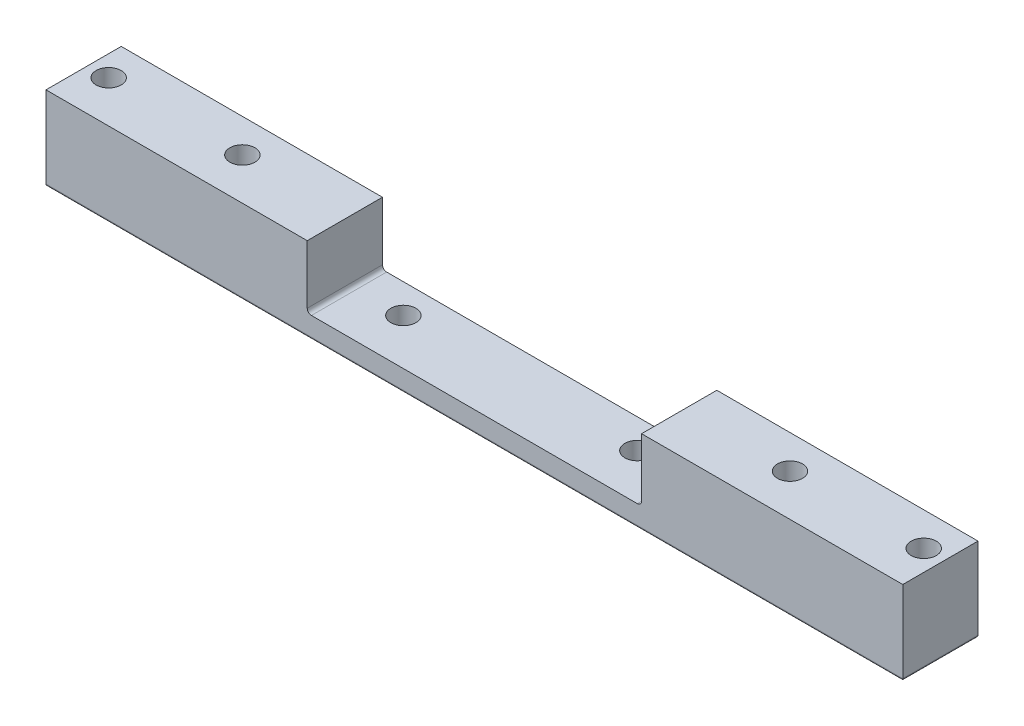
from build123d import *

# Parameters (mm, degrees)
SKETCH1_W             = 62.4967
SKETCH1_H             = 18
SKETCH1_R             = 3
BOSS_EXTRUDE1_DEPTH   = 20
SKETCH1_W_2           = 62.5033
BOSS_EXTRUDE1_2_DEPTH = 20
SKETCH1_3_W           = 80
SKETCH1_3_H           = 18
SKETCH1_3_R           = 3
BOSS_EXTRUDE2_DEPTH   = 5
FILLET1_R             = 0.5
FILLET2_R             = 1


with BuildPart() as part:
    # Sketch1 → Boss-Extrude1 (new body)
    with BuildSketch(Plane(origin=(0, 0, 0), x_dir=(1, 0, 0), z_dir=(0, 1, 0))):
        with Locations((173.75165, -9)):
            Rectangle(SKETCH1_W, SKETCH1_H)
        with Locations((168.0133, -8)):
            Circle(SKETCH1_R, mode=Mode.SUBTRACT)
        with Locations((200.0133, -8)):
            Circle(SKETCH1_R, mode=Mode.SUBTRACT)
    extrude(amount=BOSS_EXTRUDE1_DEPTH)



with BuildPart() as body_2:
    # Sketch1 → Boss-Extrude1 2 (new body)
    with BuildSketch(Plane(origin=(0, 0, 0), x_dir=(1, 0, 0), z_dir=(0, 1, 0))):
        with Locations((31.25165, -9)):
            Rectangle(SKETCH1_W_2, SKETCH1_H)
        with Locations((4.99, -8)):
            Circle(SKETCH1_R, mode=Mode.SUBTRACT)
        with Locations((36.99, -8)):
            Circle(SKETCH1_R, mode=Mode.SUBTRACT)
    extrude(amount=BOSS_EXTRUDE1_2_DEPTH)


with BuildPart() as part_1:
    add(part.part)

    add(body_2.part)  # Boss-Extrude2 merges body 2
    # Sketch1<3> → Boss-Extrude2 (add)
    with BuildSketch(Plane(origin=(0, 0, 0), x_dir=(1, 0, 0), z_dir=(0, 1, 0))):
        with Locations((102.5033, -9)):
            Rectangle(SKETCH1_3_W, SKETCH1_3_H)
        with Locations((74.5033, -7)):
            Circle(SKETCH1_3_R, mode=Mode.SUBTRACT)
        with Locations((130.5033, -7)):
            Circle(SKETCH1_3_R, mode=Mode.SUBTRACT)
    extrude(amount=BOSS_EXTRUDE2_DEPTH)

    # Fillet1
    fillet1_edges = [part_1.edges().sort_by_distance(p)[0] for p in [
        (165.0133, 0, 8),
        (197.0133, 0, 8),
        (71.5033, 0, 7),
        (127.5033, 0, 7),
        (0, 0, 9),
        (102.5, 0, 18),
        (205, 0, 9),
        (102.5, 0, 0),
        (1.99, 0, 8),
        (33.99, 0, 8),
    ]]
    fillet(fillet1_edges, radius=FILLET1_R)

    # Fillet2
    fillet2_edges = [part_1.edges().sort_by_distance(p)[0] for p in [
        (62.5033, 5, 9),
        (142.5033, 5, 9),
    ]]
    fillet(fillet2_edges, radius=FILLET2_R)


solid = part_1.part
